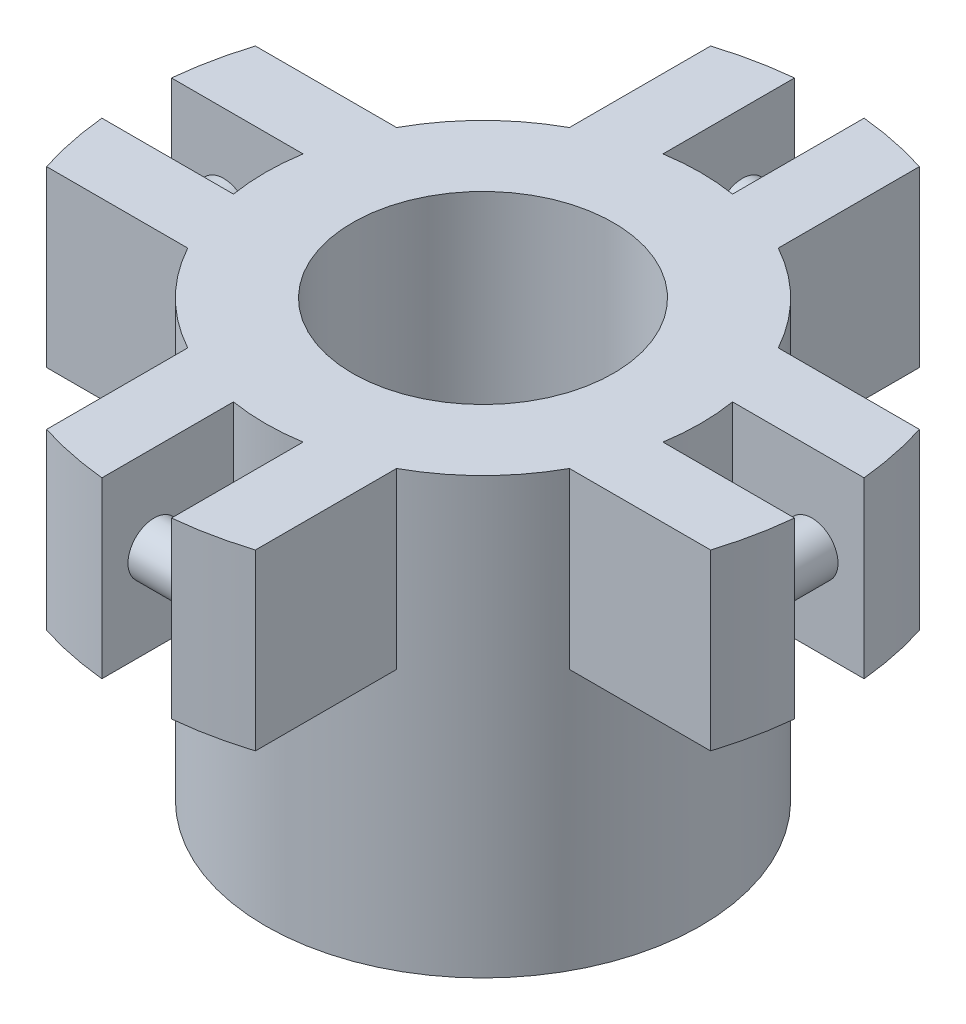
from build123d import *

# Parameters (mm, degrees)
SKETCH1_R           = 12.5
SKETCH1_R_2         = 7.5
BOSS_EXTRUDE1_DEPTH = 20
SKETCH2_R           = 7.5
BOSS_EXTRUDE2_DEPTH = 5
SKETCH3_R           = 1.5
BOSS_EXTRUDE3_DEPTH = 7
CIRPATTERN1_COUNT   = 4


with BuildPart() as part:
    # Sketch1 → Boss-Extrude1 (new body)
    with BuildSketch(Plane(origin=(0, 0, 0), x_dir=(1, 0, 0), z_dir=(0, 1, 0))):
        with Locations(Location((0, 0, 0), (0, 0, 270))):
            Circle(SKETCH1_R)
        with Locations(Location((0, 0, 0), (0, 0, 270))):
            Circle(SKETCH1_R_2, mode=Mode.SUBTRACT)
    extrude(amount=BOSS_EXTRUDE1_DEPTH)

    # Sketch2 → Boss-Extrude2 (add, symmetric)
    with BuildSketch(Plane(origin=(0, 20, 0), x_dir=(1, 0, 0), z_dir=(0, 1, 0))):
        with BuildLine():
            Line((-2, 19.899749), (-2, 12.338963))
            ThreePointArc((-2, 12.338963), (0, 12.5), (2, 12.338963))
            Line((2, 12.338963), (2, 19.899749))
            ThreePointArc((2, 19.899749), (4.021007, 19.591618), (6, 19.078784))
            Line((6, 19.078784), (6, 10.965856))
            ThreePointArc((6, 10.965856), (8.838835, 8.838835), (10.965856, 6))
            Line((10.965856, 6), (19.078784, 6))
            ThreePointArc((19.078784, 6), (19.591618, 4.021007), (19.899749, 2))
            Line((19.899749, 2), (12.338963, 2))
            ThreePointArc((12.338963, 2), (12.5, 0), (12.338963, -2))
            Line((12.338963, -2), (19.899749, -2))
            ThreePointArc((19.899749, -2), (19.591618, -4.021007), (19.078784, -6))
            Line((19.078784, -6), (10.965856, -6))
            ThreePointArc((10.965856, -6), (8.838835, -8.838835), (6, -10.965856))
            Line((6, -10.965856), (6, -19.078784))
            ThreePointArc((6, -19.078784), (4.021007, -19.591618), (2, -19.899749))
            Line((2, -19.899749), (2, -12.338963))
            ThreePointArc((2, -12.338963), (0, -12.5), (-2, -12.338963))
            Line((-2, -12.338963), (-2, -19.899749))
            ThreePointArc((-2, -19.899749), (-4.021007, -19.591618), (-6, -19.078784))
            Line((-6, -19.078784), (-6, -10.965856))
            ThreePointArc((-6, -10.965856), (-8.838835, -8.838835), (-10.965856, -6))
            Line((-10.965856, -6), (-19.078784, -6))
            ThreePointArc((-19.078784, -6), (-19.591618, -4.021007), (-19.899749, -2))
            Line((-19.899749, -2), (-12.338963, -2))
            ThreePointArc((-12.338963, -2), (-12.5, 0), (-12.338963, 2))
            Line((-12.338963, 2), (-19.899749, 2))
            ThreePointArc((-19.899749, 2), (-19.591618, 4.021007), (-19.078784, 6))
            Line((-19.078784, 6), (-10.965856, 6))
            ThreePointArc((-10.965856, 6), (-8.838835, 8.838835), (-6, 10.965856))
            Line((-6, 10.965856), (-6, 19.078784))
            ThreePointArc((-6, 19.078784), (-4.021007, 19.591618), (-2, 19.899749))
        make_face()
        with Locations(Location((0, 0, 0), (0, 0, 270))):
            Circle(SKETCH2_R, mode=Mode.SUBTRACT)
    extrude(amount=BOSS_EXTRUDE2_DEPTH, both=True)

    # Sketch3 → Boss-Extrude3 (add)
    with BuildSketch(Plane.XY.offset(-2)):
        with Locations(Location((-16.899749, 20, 0), (0, 0, 180))):
            Circle(SKETCH3_R)
    boss_extrude3 = extrude(amount=BOSS_EXTRUDE3_DEPTH)

    # CirPattern1: Boss-Extrude3 ×4 about axis
    cirpattern1_axis = Axis((0, 0, 0), (0, -1, 0))
    for i in range(1, CIRPATTERN1_COUNT):
        add(boss_extrude3.rotate(cirpattern1_axis, i * 360 / CIRPATTERN1_COUNT))


solid = part.part
